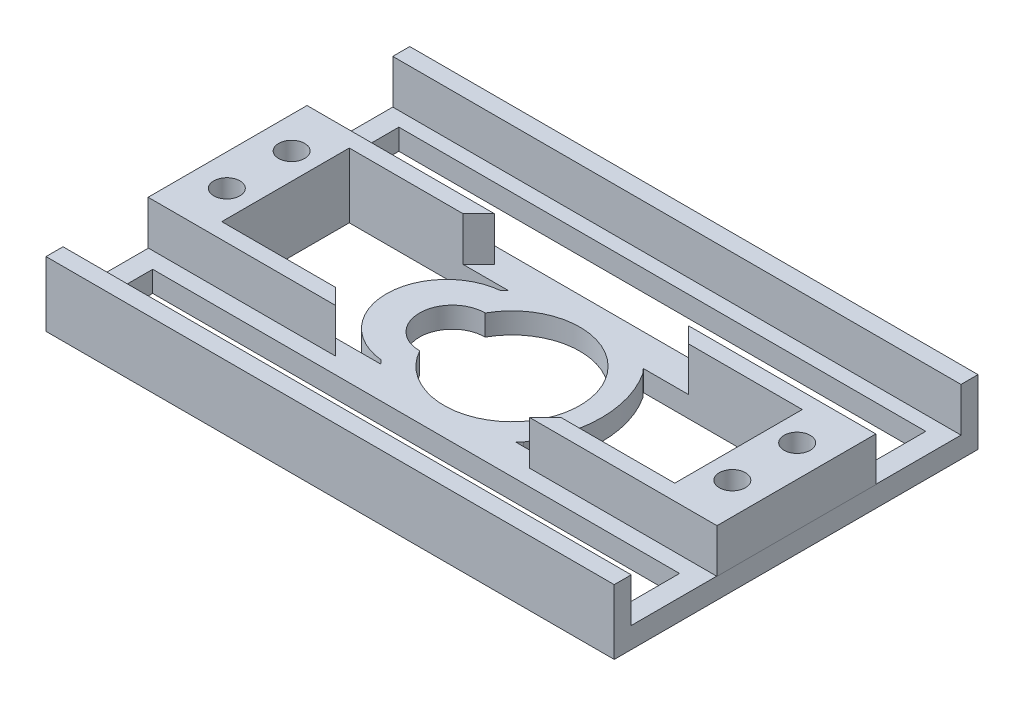
from build123d import *

# Parameters (mm, degrees)
SKETCH1_W               = 54.356
SKETCH1_H               = 34.798
SKETCH1_R               = 1.250004527
SKETCH1_W_2             = 50.4000008
SKETCH1_H_2             = 5.2500022
BOSS_EXTRUDE1_DEPTH     = 1.999996
SKETCH2_W               = 54.356
SKETCH2_H               = 1.626997
BOSS_EXTRUDE2_DEPTH     = 4.1999916
SKETCH3_R               = 1.250004527
BOSS_EXTRUDE3_DEPTH     = 4.1999916
CUT_EXTRUDE1_DEPTH      = 33.88498208
CUT_EXTRUDE1_DEPTH_BACK = 33.88498208


with BuildPart() as part:
    # Sketch1 → Boss-Extrude1 (new body)
    with BuildSketch(Plane(origin=(0, 0, 0), x_dir=(1, 0, 0), z_dir=(0, 1, 0))):
        Rectangle(SKETCH1_W, SKETCH1_H)
        with Locations(Location((24.178011673, 3.099006966, 0), (0, 0, 270))):
            Circle(SKETCH1_R, mode=Mode.SUBTRACT)
        with Locations(Location((24.178011673, -3.099006966, 0), (0, 0, 90))):
            Circle(SKETCH1_R, mode=Mode.SUBTRACT)
        with Locations(Location((-24.178011673, -3.099006966, 0), (0, 0, 270))):
            Circle(SKETCH1_R, mode=Mode.SUBTRACT)
        with Locations(Location((-24.178011673, 3.099006966, 0), (0, 0, 90))):
            Circle(SKETCH1_R, mode=Mode.SUBTRACT)
        with Locations((-0.0219964, 11.7740049)):
            Rectangle(SKETCH1_W_2, SKETCH1_H_2, mode=Mode.SUBTRACT)
        with Locations((-0.0219964, -11.7740049)):
            Rectangle(SKETCH1_W_2, SKETCH1_H_2, mode=Mode.SUBTRACT)
    extrude(amount=BOSS_EXTRUDE1_DEPTH)

    # Sketch2 → Boss-Extrude2 (add)
    with BuildSketch(Plane(origin=(0, 1.999996, 0), x_dir=(1, 0, 0), z_dir=(0, 1, 0))):
        with Locations((0, 16.5855015)):
            Rectangle(SKETCH2_W, SKETCH2_H)
        with Locations((0, -16.5855015)):
            Rectangle(SKETCH2_W, SKETCH2_H)
    extrude(amount=BOSS_EXTRUDE2_DEPTH)

    # Sketch3 → Boss-Extrude3 (add)
    # profile 1 of 2: a face of its own
    with BuildSketch(Plane(origin=(0, 1.999996, 0), x_dir=(1, 0, 0), z_dir=(0, 1, 0))):
        Polygon((-27.207664346, 7.5999975), (-9.294212746, 7.5999975), (-10.799929046, 6.1000005), (-21.665998246, 6.1000005), (-21.665998246, -6.1000005), (-10.799929046, -6.1000005), (-9.294212746, -7.5999975), (-27.207664346, -7.5999975), align=None)
        with Locations(Location((-24.178011673, -3.099006966, 0), (0, 0, 270))):
            Circle(SKETCH3_R, mode=Mode.SUBTRACT)
        with Locations(Location((-24.178011673, 3.099006966, 0), (0, 0, 90))):
            Circle(SKETCH3_R, mode=Mode.SUBTRACT)
    # profile 2 of 2: a face of its own
    with BuildSketch(Plane(origin=(0, 1.999996, 0), x_dir=(1, 0, 0), z_dir=(0, 1, 0))):
        Polygon((27.207664346, -7.5999975), (9.294212746, -7.5999975), (10.799929046, -6.1000005), (21.665998246, -6.1000005), (21.665998246, 6.1000005), (10.799929046, 6.1000005), (9.294212746, 7.5999975), (27.207664346, 7.5999975), align=None)
        with Locations(Location((24.178011673, 3.099006966, 0), (0, 0, 90))):
            Circle(SKETCH3_R, mode=Mode.SUBTRACT)
        with Locations(Location((24.178011673, -3.099006966, 0), (0, 0, 90))):
            Circle(SKETCH3_R, mode=Mode.SUBTRACT)
    extrude(amount=BOSS_EXTRUDE3_DEPTH)

    # Sketch4 → Cut-Extrude1 (cut, two sides: drawn at the far end of the back side and taken through both)
    with BuildSketch(Plane.XZ.offset(-CUT_EXTRUDE1_DEPTH_BACK)):
        with BuildLine():
            ThreePointArc((-5.694081512, -3.1348976), (6.500011325, 0), (-5.694081512, 3.1348976))
            ThreePointArc((-5.694081512, 3.1348976), (-8.840003041, 0), (-5.694081512, -3.1348976))
        make_face()
        with BuildLine():
            ThreePointArc((-6.817717046, 5.7234709), (-12.015990113, 0), (-6.817717046, -5.7234709))
            Line((-6.817717046, -5.7234709), (-6.457037046, -6.1000005))
            Line((-6.457037046, -6.1000005), (-10.799929046, -6.1000005))
            Line((-10.799929046, -6.1000005), (-21.665998246, -6.1000005))
            Line((-21.665998246, -6.1000005), (-21.665998246, 6.1000005))
            Line((-21.665998246, 6.1000005), (-10.799929046, 6.1000005))
            Line((-10.799929046, 6.1000005), (-6.457037046, 6.1000005))
            Line((-6.457037046, 6.1000005), (-6.817717046, 5.7234709))
        make_face()
        with BuildLine():
            Line((6.457037046, 6.1000005), (6.817717046, 5.7234709))
            ThreePointArc((6.817717046, 5.7234709), (8.544974069, 0), (6.817717046, -5.7234709))
            Line((6.817717046, -5.7234709), (6.457037046, -6.1000005))
            Line((6.457037046, -6.1000005), (10.799929046, -6.1000005))
            Line((10.799929046, -6.1000005), (21.665998246, -6.1000005))
            Line((21.665998246, -6.1000005), (21.665998246, 6.1000005))
            Line((21.665998246, 6.1000005), (10.799929046, 6.1000005))
            Line((10.799929046, 6.1000005), (6.457037046, 6.1000005))
        make_face()
    extrude(amount=CUT_EXTRUDE1_DEPTH + CUT_EXTRUDE1_DEPTH_BACK, mode=Mode.SUBTRACT)


solid = part.part
